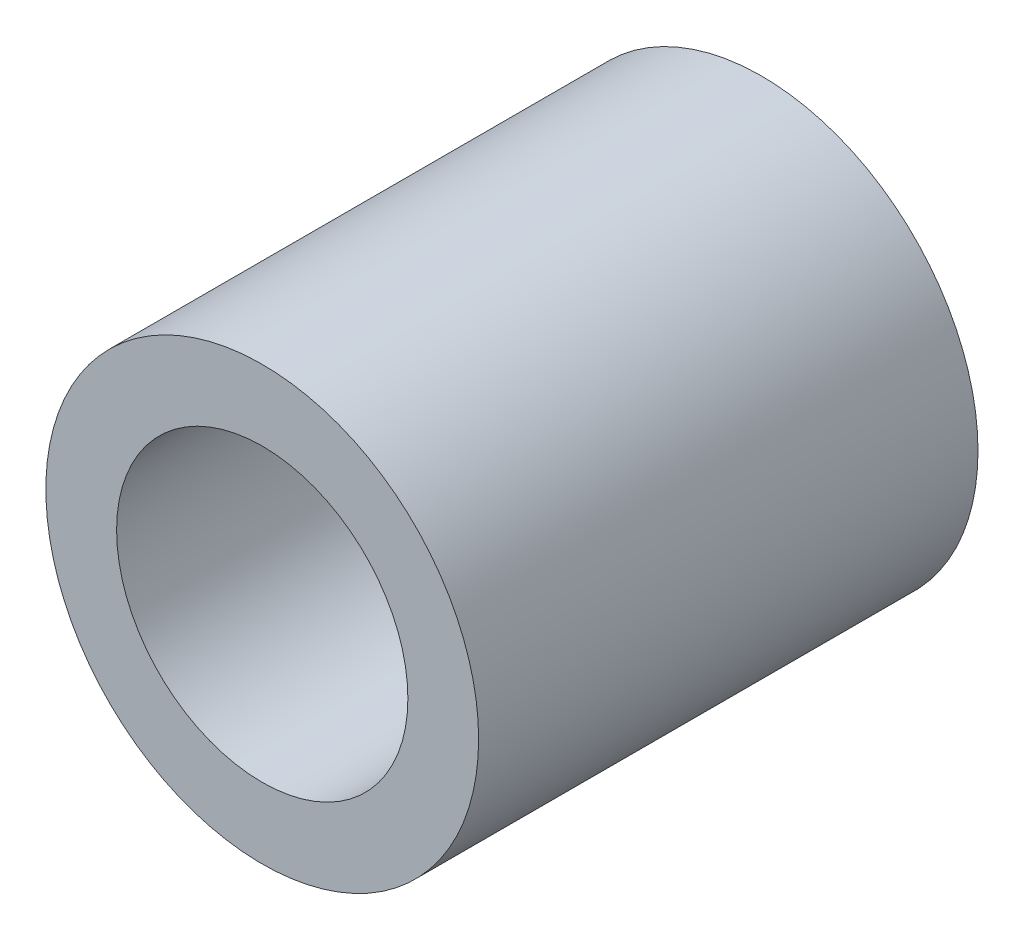
from build123d import *

# Parameters (mm, degrees)
ESBO_O1_R                = 2.6
ESBO_O1_R_2              = 1.75
RESSALTO_EXTRUS_O1_DEPTH = 6


with BuildPart() as part:
    # Esboço1 → Ressalto-extrusão1 (new body)
    with BuildSketch(Plane.XY):
        Circle(ESBO_O1_R)
        Circle(ESBO_O1_R_2, mode=Mode.SUBTRACT)
    extrude(amount=RESSALTO_EXTRUS_O1_DEPTH)


solid = part.part
